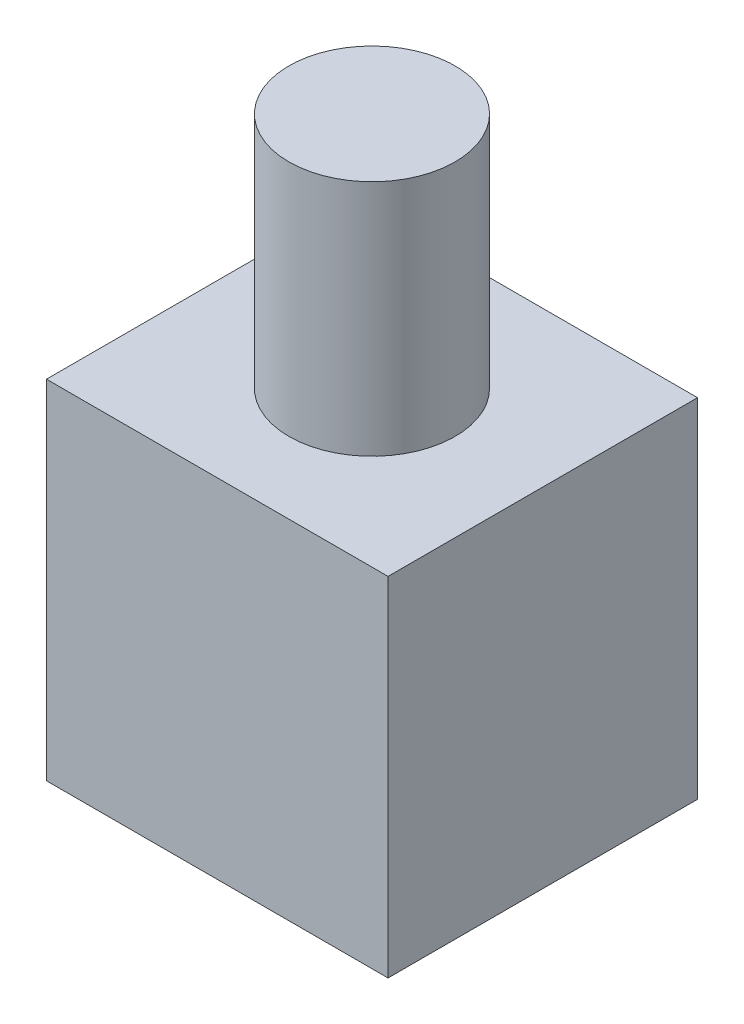
from build123d import *

# Parameters (mm, degrees)
SKETCH1_W           = 12.57
SKETCH1_H           = 11.39
BOSS_EXTRUDE1_DEPTH = 12.8
SKETCH2_R           = 3.06
BOSS_EXTRUDE2_DEPTH = 8.75


with BuildPart() as part:
    # Sketch1 → Boss-Extrude1 (new body)
    with BuildSketch(Plane(origin=(0, 0, 0), x_dir=(1, 0, 0), z_dir=(0, 1, 0))):
        with Locations((6.285, 5.695)):
            Rectangle(SKETCH1_W, SKETCH1_H)
    extrude(amount=BOSS_EXTRUDE1_DEPTH)

    # Sketch2 → Boss-Extrude2 (add)
    with BuildSketch(Plane(origin=(0, 12.8, 0), x_dir=(1, 0, 0), z_dir=(0, 1, 0))):
        with Locations(Location((6.285, 5.695, 0), (0, 0, 270))):
            Circle(SKETCH2_R)
    extrude(amount=BOSS_EXTRUDE2_DEPTH)


solid = part.part
